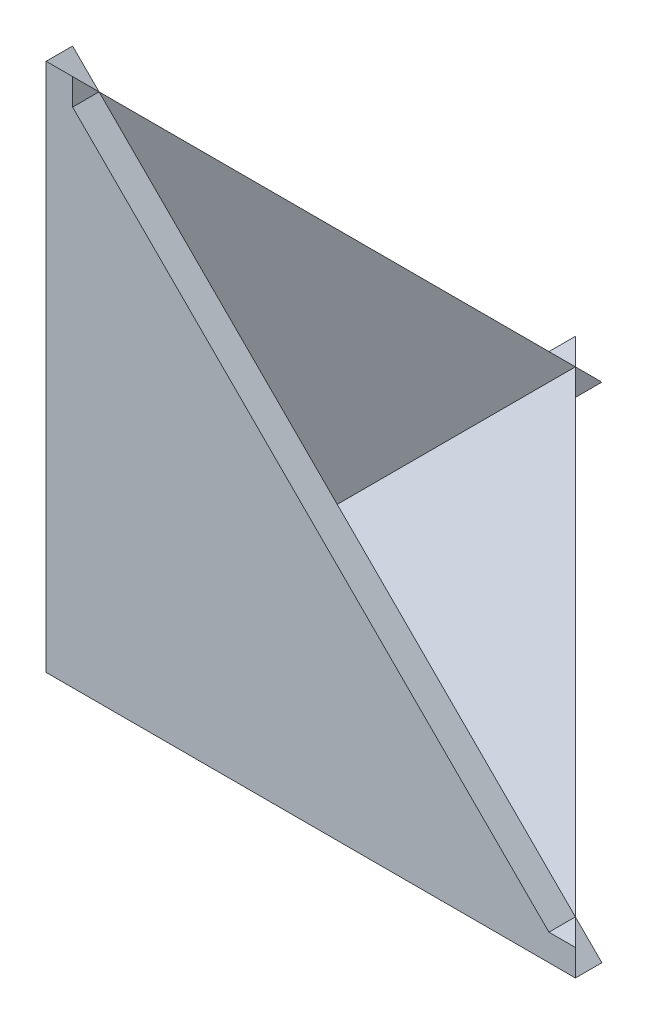
from build123d import *

# Parameters (mm, degrees)
BOSS_EXTRUDE5_DEPTH = 0.5
BOSS_EXTRUDE6_DEPTH = 0.5
BOSS_EXTRUDE7_DEPTH = 0.5


with BuildPart() as part:
    # Sketch2 → Boss-Extrude5 (new body)
    with BuildSketch(Plane(origin=(0, 0, 0), x_dir=(1, 0, 0), z_dir=(0, 1, 0))):
        Polygon((0, 10), (0, 0), (10, 0), align=None)
    extrude(amount=BOSS_EXTRUDE5_DEPTH)

    # Sketch3 → Boss-Extrude6 (add)
    with BuildSketch(Plane.XY):
        Polygon((0, 0), (0, 10), (10, 0), align=None)
    extrude(amount=-BOSS_EXTRUDE6_DEPTH)

    # Sketch4 → Boss-Extrude7 (add)
    with BuildSketch(Plane.ZY):
        Polygon((-10, 0), (0, 0), (0, 10), align=None)
    extrude(amount=-BOSS_EXTRUDE7_DEPTH)


solid = part.part
